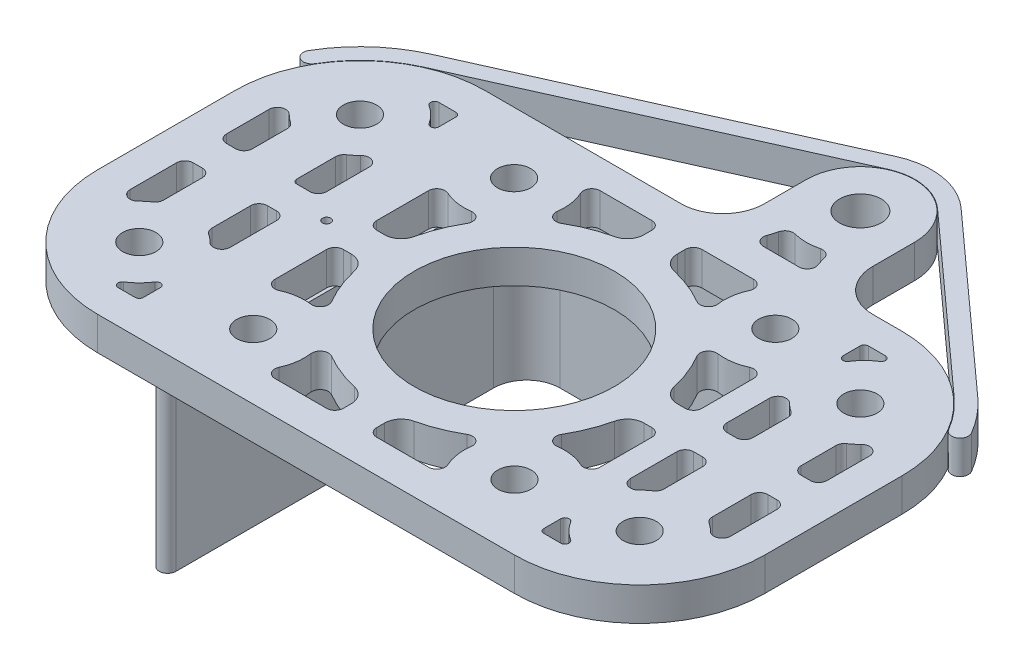
from build123d import *

# Parameters (mm, degrees)
SKETCH1_R             = 2
SKETCH1_R_2           = 12
SKETCH1_R_3           = 0.5
SKETCH1_R_4           = 2.5
BOSS_EXTRUDE1_DEPTH   = 4
BOSS_EXTRUDE1_2_DEPTH = 4
BOSS_EXTRUDE2_DEPTH   = 20
BOSS_EXTRUDE3_DEPTH   = 3


with BuildPart() as part:
    # Sketch1 → Boss-Extrude1 (new body)
    with BuildSketch(Plane(origin=(0, 0, 0), x_dir=(1, 0, 0), z_dir=(0, 1, 0))):
        with BuildLine():
            Line((-26.5, -23), (-3, -23))
            ThreePointArc((-3, -23), (0.535533906, -24.464466094), (2, -28))
            Line((2, -28), (2, -33))
            ThreePointArc((2, -33), (8.5, -39.5), (15, -33))
            Line((15, -33), (15, -28))
            ThreePointArc((15, -28), (16.464466094, -24.464466094), (20, -23))
            Line((20, -23), (23.5, -23))
            ThreePointArc((23.5, -23), (34.106601718, -18.606601718), (38.5, -8))
            Line((38.5, -8), (38.5, 8.46372283))
            ThreePointArc((38.5, 8.46372283), (34.106601718, 19.070324548), (23.5, 23.46372283))
            Line((23.5, 23.46372283), (-26.5, 23.46372283))
            ThreePointArc((-26.5, 23.46372283), (-37.106601718, 19.070324548), (-41.5, 8.46372283))
            Line((-41.5, 8.46372283), (-41.5, -8))
            ThreePointArc((-41.5, -8), (-37.106601718, -18.606601718), (-26.5, -23))
        make_face()
        with Locations(Location((-31.5, 13.46372283, 0), (0, 0, 270))):
            Circle(SKETCH1_R, mode=Mode.SUBTRACT)
        with Locations(Location((28.5, 13.46372283, 0), (0, 0, 270))):
            Circle(SKETCH1_R, mode=Mode.SUBTRACT)
        with Locations(Location((0, 0, 0), (0, 0, 270))):
            Circle(SKETCH1_R_2, mode=Mode.SUBTRACT)
        with Locations(Location((-15.637811111, 15.662146765, 0), (0, 0, 270))):
            Circle(SKETCH1_R, mode=Mode.SUBTRACT)
        with Locations(Location((15.662146765, 15.637811111, 0), (0, 0, 270))):
            Circle(SKETCH1_R, mode=Mode.SUBTRACT)
        with Locations(Location((15.637811111, -15.662146765, 0), (0, 0, 270))):
            Circle(SKETCH1_R, mode=Mode.SUBTRACT)
        with Locations(Location((-15.662146765, -15.637811111, 0), (0, 0, 270))):
            Circle(SKETCH1_R, mode=Mode.SUBTRACT)
        with Locations(Location((28.5, -13, 0), (0, 0, 270))):
            Circle(SKETCH1_R, mode=Mode.SUBTRACT)
        with Locations(Location((-31.5, -13, 0), (0, 0, 270))):
            Circle(SKETCH1_R, mode=Mode.SUBTRACT)
        with Locations(Location((-22.5, 0, 0), (0, 0, 270))):
            Circle(SKETCH1_R_3, mode=Mode.SUBTRACT)
        with Locations(Location((8.5, -33, 0), (0, 0, 270))):
            Circle(SKETCH1_R_4, mode=Mode.SUBTRACT)
        with BuildLine():
            Line((19.5, -3), (19.5, -9.206263146))
            ThreePointArc((19.5, -9.206263146), (19.041462955, -10.046987755), (18.086364264, -10.116705609))
            ThreePointArc((18.086364264, -10.116705609), (16.465532816, -9.638381302), (14.7756495, -9.624849747))
            ThreePointArc((14.7756495, -9.624849747), (13.810727907, -9.185503496), (13.78311178, -8.125627956))
            ThreePointArc((13.78311178, -8.125627956), (14.868163127, -5.910814262), (15.599936689, -3.555555556))
            ThreePointArc((15.599936689, -3.555555556), (16.302709646, -2.43652808), (17.549928775, -2))
            Line((17.549928775, -2), (18.5, -2))
            ThreePointArc((18.5, -2), (19.207106781, -2.292893219), (19.5, -3))
        make_face(mode=Mode.SUBTRACT)
        with BuildLine():
            Line((19.5, 9.206263146), (19.5, 3))
            ThreePointArc((19.5, 3), (19.207106781, 2.292893219), (18.5, 2))
            Line((18.5, 2), (17.549928775, 2))
            ThreePointArc((17.549928775, 2), (16.302709646, 2.43652808), (15.599936689, 3.555555556))
            ThreePointArc((15.599936689, 3.555555556), (14.868163127, 5.910814262), (13.78311178, 8.125627956))
            ThreePointArc((13.78311178, 8.125627956), (13.810727907, 9.185503495), (14.7756495, 9.624849747))
            ThreePointArc((14.7756495, 9.624849747), (16.465532816, 9.638381302), (18.086364264, 10.116705609))
            ThreePointArc((18.086364264, 10.116705609), (19.041462955, 10.046987755), (19.5, 9.206263146))
        make_face(mode=Mode.SUBTRACT)
        with BuildLine():
            Line((-34.4, 7.650806178), (-34.4, 3))
            ThreePointArc((-34.4, 3), (-34.692893219, 2.292893219), (-35.4, 2))
            Line((-35.4, 2), (-36.5, 2))
            ThreePointArc((-36.5, 2), (-37.207106781, 2.292893219), (-37.5, 3))
            Line((-37.5, 3), (-37.5, 8.564743344))
            ThreePointArc((-37.5, 8.564743344), (-36.877964473, 9.490563444), (-35.785714286, 9.264597557))
            ThreePointArc((-35.785714286, 9.264597557), (-35.334344076, 8.848768279), (-34.842857143, 8.481222843))
            ThreePointArc((-34.842857143, 8.481222843), (-34.517633053, 8.121368152), (-34.4, 7.650806178))
        make_face(mode=Mode.SUBTRACT)
        with BuildLine():
            Line((-28.6, 7.650806178), (-28.6, 3))
            ThreePointArc((-28.6, 3), (-28.307106781, 2.292893219), (-27.6, 2))
            Line((-27.6, 2), (-26.5, 2))
            ThreePointArc((-26.5, 2), (-25.792893219, 2.292893219), (-25.5, 3))
            Line((-25.5, 3), (-25.5, 8.564743344))
            ThreePointArc((-25.5, 8.564743344), (-26.122035527, 9.490563444), (-27.214285714, 9.264597557))
            ThreePointArc((-27.214285714, 9.264597557), (-27.665655924, 8.848768279), (-28.157142857, 8.481222843))
            ThreePointArc((-28.157142857, 8.481222843), (-28.482366947, 8.121368152), (-28.6, 7.650806178))
        make_face(mode=Mode.SUBTRACT)
        with BuildLine():
            Line((-37.5, -8.101020514), (-37.5, -3))
            ThreePointArc((-37.5, -3), (-37.207106781, -2.292893219), (-36.5, -2))
            Line((-36.5, -2), (-35.4, -2))
            ThreePointArc((-35.4, -2), (-34.692893219, -2.292893219), (-34.4, -3))
            Line((-34.4, -3), (-34.4, -7.187083348))
            ThreePointArc((-34.4, -7.187083348), (-34.517633053, -7.657645322), (-34.842857143, -8.017500013))
            ThreePointArc((-34.842857143, -8.017500013), (-35.334344076, -8.385045449), (-35.785714286, -8.800874727))
            ThreePointArc((-35.785714286, -8.800874727), (-36.877964473, -9.026840614), (-37.5, -8.101020514))
        make_face(mode=Mode.SUBTRACT)
        with BuildLine():
            Line((-3, -19.5), (-9.206263146, -19.5))
            ThreePointArc((-9.206263146, -19.5), (-10.046987755, -19.041462955), (-10.116705609, -18.086364264))
            ThreePointArc((-10.116705609, -18.086364264), (-9.638381302, -16.465532816), (-9.624849747, -14.7756495))
            ThreePointArc((-9.624849747, -14.7756495), (-9.185503496, -13.810727907), (-8.125627956, -13.78311178))
            ThreePointArc((-8.125627956, -13.78311178), (-5.910814262, -14.868163127), (-3.555555556, -15.599936689))
            ThreePointArc((-3.555555556, -15.599936689), (-2.43652808, -16.302709646), (-2, -17.549928775))
            Line((-2, -17.549928775), (-2, -18.5))
            ThreePointArc((-2, -18.5), (-2.292893219, -19.207106781), (-3, -19.5))
        make_face(mode=Mode.SUBTRACT)
        with BuildLine():
            Line((9.206263146, -19.5), (3, -19.5))
            ThreePointArc((3, -19.5), (2.292893219, -19.207106781), (2, -18.5))
            Line((2, -18.5), (2, -17.549928775))
            ThreePointArc((2, -17.549928775), (2.43652808, -16.302709646), (3.555555556, -15.599936689))
            ThreePointArc((3.555555556, -15.599936689), (5.910814262, -14.868163127), (8.125627956, -13.78311178))
            ThreePointArc((8.125627956, -13.78311178), (9.185503495, -13.810727907), (9.624849747, -14.7756495))
            ThreePointArc((9.624849747, -14.7756495), (9.638381302, -16.465532816), (10.116705609, -18.086364264))
            ThreePointArc((10.116705609, -18.086364264), (10.046987755, -19.041462955), (9.206263146, -19.5))
        make_face(mode=Mode.SUBTRACT)
        with BuildLine():
            Line((-19.5, 3), (-19.5, 9.206263146))
            ThreePointArc((-19.5, 9.206263146), (-19.041462955, 10.046987755), (-18.086364264, 10.116705609))
            ThreePointArc((-18.086364264, 10.116705609), (-16.465532816, 9.638381302), (-14.7756495, 9.624849747))
            ThreePointArc((-14.7756495, 9.624849747), (-13.810727907, 9.185503496), (-13.78311178, 8.125627956))
            ThreePointArc((-13.78311178, 8.125627956), (-14.868163127, 5.910814262), (-15.599936689, 3.555555556))
            ThreePointArc((-15.599936689, 3.555555556), (-16.302709646, 2.43652808), (-17.549928775, 2))
            Line((-17.549928775, 2), (-18.5, 2))
            ThreePointArc((-18.5, 2), (-19.207106781, 2.292893219), (-19.5, 3))
        make_face(mode=Mode.SUBTRACT)
        with BuildLine():
            Line((-19.5, -9.206263146), (-19.5, -3))
            ThreePointArc((-19.5, -3), (-19.207106781, -2.292893219), (-18.5, -2))
            Line((-18.5, -2), (-17.549928775, -2))
            ThreePointArc((-17.549928775, -2), (-16.302709646, -2.43652808), (-15.599936689, -3.555555556))
            ThreePointArc((-15.599936689, -3.555555556), (-14.868163127, -5.910814262), (-13.78311178, -8.125627956))
            ThreePointArc((-13.78311178, -8.125627956), (-13.810727907, -9.185503495), (-14.7756495, -9.624849747))
            ThreePointArc((-14.7756495, -9.624849747), (-16.465532816, -9.638381302), (-18.086364264, -10.116705609))
            ThreePointArc((-18.086364264, -10.116705609), (-19.041462955, -10.046987755), (-19.5, -9.206263146))
        make_face(mode=Mode.SUBTRACT)
        with BuildLine():
            Line((-9.206263146, 19.5), (-3, 19.5))
            ThreePointArc((-3, 19.5), (-2.292893219, 19.207106781), (-2, 18.5))
            Line((-2, 18.5), (-2, 17.549928775))
            ThreePointArc((-2, 17.549928775), (-2.43652808, 16.302709646), (-3.555555556, 15.599936689))
            ThreePointArc((-3.555555556, 15.599936689), (-5.910814262, 14.868163127), (-8.125627956, 13.78311178))
            ThreePointArc((-8.125627956, 13.78311178), (-9.185503495, 13.810727907), (-9.624849747, 14.7756495))
            ThreePointArc((-9.624849747, 14.7756495), (-9.638381302, 16.465532816), (-10.116705609, 18.086364264))
            ThreePointArc((-10.116705609, 18.086364264), (-10.046987755, 19.041462955), (-9.206263146, 19.5))
        make_face(mode=Mode.SUBTRACT)
        with BuildLine():
            Line((-25.5, 16.927824445), (-25.5, 18.96372283))
            ThreePointArc((-25.5, 18.96372283), (-25.64644661, 19.317276221), (-26, 19.46372283))
            Line((-26, 19.46372283), (-28.035898385, 19.46372283))
            ThreePointArc((-28.035898385, 19.46372283), (-28.516282846, 19.102397879), (-28.30236774, 18.540645907))
            ThreePointArc((-28.30236774, 18.540645907), (-27.257359313, 17.706363517), (-26.423076923, 16.66135509))
            ThreePointArc((-26.423076923, 16.66135509), (-25.861324951, 16.447439984), (-25.5, 16.927824445))
        make_face(mode=Mode.SUBTRACT)
        with BuildLine():
            Line((2, 18.5), (2, 17.549928775))
            ThreePointArc((2, 17.549928775), (2.43652808, 16.302709646), (3.555555556, 15.599936689))
            ThreePointArc((3.555555556, 15.599936689), (5.910814262, 14.868163127), (8.125627956, 13.78311178))
            ThreePointArc((8.125627956, 13.78311178), (9.185503496, 13.810727907), (9.624849747, 14.7756495))
            ThreePointArc((9.624849747, 14.7756495), (9.638381302, 16.465532816), (10.116705609, 18.086364264))
            ThreePointArc((10.116705609, 18.086364264), (10.046987755, 19.041462955), (9.206263146, 19.5))
            Line((9.206263146, 19.5), (3, 19.5))
            ThreePointArc((3, 19.5), (2.292893219, 19.207106781), (2, 18.5))
        make_face(mode=Mode.SUBTRACT)
        with BuildLine():
            Line((-26.5, -2), (-28.1, -2))
            ThreePointArc((-28.1, -2), (-28.453553391, -2.146446609), (-28.6, -2.5))
            Line((-28.6, -2.5), (-28.6, -7.187083348))
            ThreePointArc((-28.6, -7.187083348), (-28.482366947, -7.657645322), (-28.157142857, -8.017500013))
            ThreePointArc((-28.157142857, -8.017500013), (-27.665655924, -8.385045449), (-27.214285714, -8.800874727))
            ThreePointArc((-27.214285714, -8.800874727), (-26.122035527, -9.026840614), (-25.5, -8.101020514))
            Line((-25.5, -8.101020514), (-25.5, -3))
            ThreePointArc((-25.5, -3), (-25.792893219, -2.292893219), (-26.5, -2))
        make_face(mode=Mode.SUBTRACT)
        with BuildLine():
            Line((-25.5, -16.464101615), (-25.5, -18.5))
            ThreePointArc((-25.5, -18.5), (-25.64644661, -18.853553391), (-26, -19))
            Line((-26, -19), (-28.035898385, -19))
            ThreePointArc((-28.035898385, -19), (-28.516282846, -18.638675049), (-28.30236774, -18.076923077))
            ThreePointArc((-28.30236774, -18.076923077), (-27.257359313, -17.242640687), (-26.423076923, -16.19763226))
            ThreePointArc((-26.423076923, -16.19763226), (-25.861324951, -15.983717154), (-25.5, -16.464101615))
        make_face(mode=Mode.SUBTRACT)
        with BuildLine():
            Line((23, -19.46372283), (25.035898385, -19.46372283))
            ThreePointArc((25.035898385, -19.46372283), (25.516282846, -19.102397879), (25.30236774, -18.540645907))
            ThreePointArc((25.30236774, -18.540645907), (24.257359313, -17.706363517), (23.423076923, -16.66135509))
            ThreePointArc((23.423076923, -16.66135509), (22.861324951, -16.447439984), (22.5, -16.927824445))
            Line((22.5, -16.927824445), (22.5, -18.96372283))
            ThreePointArc((22.5, -18.96372283), (22.646446609, -19.317276221), (23, -19.46372283))
        make_face(mode=Mode.SUBTRACT)
        with BuildLine():
            Line((22.5, -8.101020514), (22.5, -3))
            ThreePointArc((22.5, -3), (22.792893219, -2.292893219), (23.5, -2))
            Line((23.5, -2), (24.6, -2))
            ThreePointArc((24.6, -2), (25.307106781, -2.292893219), (25.6, -3))
            Line((25.6, -3), (25.6, -7.187083348))
            ThreePointArc((25.6, -7.187083348), (25.482366947, -7.657645322), (25.157142857, -8.017500013))
            ThreePointArc((25.157142857, -8.017500013), (24.665655924, -8.385045449), (24.214285714, -8.800874727))
            ThreePointArc((24.214285714, -8.800874727), (23.122035527, -9.026840614), (22.5, -8.101020514))
        make_face(mode=Mode.SUBTRACT)
        with BuildLine():
            Line((22.5, 16.927824445), (22.5, 18.96372283))
            ThreePointArc((22.5, 18.96372283), (22.646446609, 19.317276221), (23, 19.46372283))
            Line((23, 19.46372283), (25.035898385, 19.46372283))
            ThreePointArc((25.035898385, 19.46372283), (25.516282846, 19.102397879), (25.30236774, 18.540645907))
            ThreePointArc((25.30236774, 18.540645907), (24.257359313, 17.706363517), (23.423076923, 16.66135509))
            ThreePointArc((23.423076923, 16.66135509), (22.861324951, 16.447439984), (22.5, 16.927824445))
        make_face(mode=Mode.SUBTRACT)
        with BuildLine():
            Line((34.5, -8.101020514), (34.5, -3))
            ThreePointArc((34.5, -3), (34.207106781, -2.292893219), (33.5, -2))
            Line((33.5, -2), (32.4, -2))
            ThreePointArc((32.4, -2), (31.692893219, -2.292893219), (31.4, -3))
            Line((31.4, -3), (31.4, -7.187083348))
            ThreePointArc((31.4, -7.187083348), (31.517633053, -7.657645322), (31.842857143, -8.017500013))
            ThreePointArc((31.842857143, -8.017500013), (32.334344076, -8.385045449), (32.785714286, -8.800874727))
            ThreePointArc((32.785714286, -8.800874727), (33.877964473, -9.026840614), (34.5, -8.101020514))
        make_face(mode=Mode.SUBTRACT)
        with BuildLine():
            Line((25.6, 7.650806178), (25.6, 3))
            ThreePointArc((25.6, 3), (25.307106781, 2.292893219), (24.6, 2))
            Line((24.6, 2), (23.5, 2))
            ThreePointArc((23.5, 2), (22.792893219, 2.292893219), (22.5, 3))
            Line((22.5, 3), (22.5, 8.564743344))
            ThreePointArc((22.5, 8.564743344), (23.122035527, 9.490563444), (24.214285714, 9.264597557))
            ThreePointArc((24.214285714, 9.264597557), (24.665655924, 8.848768279), (25.157142857, 8.481222843))
            ThreePointArc((25.157142857, 8.481222843), (25.482366947, 8.121368152), (25.6, 7.650806178))
        make_face(mode=Mode.SUBTRACT)
        with BuildLine():
            Line((31.4, 7.650806178), (31.4, 3))
            ThreePointArc((31.4, 3), (31.692893219, 2.292893219), (32.4, 2))
            Line((32.4, 2), (33.5, 2))
            ThreePointArc((33.5, 2), (34.207106781, 2.292893219), (34.5, 3))
            Line((34.5, 3), (34.5, 8.564743344))
            ThreePointArc((34.5, 8.564743344), (33.877964473, 9.490563444), (32.785714286, 9.264597557))
            ThreePointArc((32.785714286, 9.264597557), (32.334344076, 8.848768279), (31.842857143, 8.481222843))
            ThreePointArc((31.842857143, 8.481222843), (31.517633053, 8.121368152), (31.4, 7.650806178))
        make_face(mode=Mode.SUBTRACT)
        with BuildLine():
            Line((10.632503002, -23.5), (6.367496998, -23.5))
            ThreePointArc((6.367496998, -23.5), (5.545913161, -23.929912287), (5.430747298, -24.85))
            ThreePointArc((5.430747298, -24.85), (5.613124693, -25.389620139), (5.761001589, -25.939696345))
            ThreePointArc((5.761001589, -25.939696345), (6.210826608, -26.562725893), (6.969853382, -26.682670554))
            ThreePointArc((6.969853382, -26.682670554), (8.5, -26.5), (10.030146618, -26.682670554))
            ThreePointArc((10.030146618, -26.682670554), (10.789173392, -26.562725893), (11.238998411, -25.939696345))
            ThreePointArc((11.238998411, -25.939696345), (11.386875307, -25.389620139), (11.569252702, -24.85))
            ThreePointArc((11.569252702, -24.85), (11.454086839, -23.929912287), (10.632503002, -23.5))
        make_face(mode=Mode.SUBTRACT)
    extrude(amount=BOSS_EXTRUDE1_DEPTH)

    # Sketch2 → Boss-Extrude2 (add)
    with BuildSketch(Plane(origin=(0, 0, 0), x_dir=(1, 0, 0), z_dir=(0, 1, 0))):
        with BuildLine():
            Line((-21.1, 21.46372283), (-21.1, -16.6))
            ThreePointArc((-21.1, -16.6), (-19.342640687, -20.842640687), (-15.1, -22.6))
            Line((-15.1, -22.6), (16.499327399, -22.6))
            ThreePointArc((16.499327399, -22.6), (17.499327399, -21.6), (16.499327399, -20.6))
            Line((16.499327399, -20.6), (-15.1, -20.6))
            ThreePointArc((-15.1, -20.6), (-17.928427125, -19.428427125), (-19.1, -16.6))
            Line((-19.1, -16.6), (-19.1, 21.46372283))
            ThreePointArc((-19.1, 21.46372283), (-20.1, 22.46372283), (-21.1, 21.46372283))
        make_face()
    extrude(amount=-BOSS_EXTRUDE2_DEPTH)

    # Sketch3 → Boss-Extrude3 (add)
    # profile 1 of 2: a face of its own
    with BuildSketch(Plane(origin=(0, 0, 0), x_dir=(1, 0, 0), z_dir=(0, 1, 0))):
        with BuildLine():
            Line((31.4, 5.56372283), (31.4, -5.1))
            ThreePointArc((31.4, -5.1), (28.5, -8), (25.6, -5.1))
            Line((25.6, -5.1), (25.6, 5.56372283))
            ThreePointArc((25.6, 5.56372283), (28.5, 8.46372283), (31.4, 5.56372283))
        make_face()
        with BuildLine():
            Line((27.6, 5.56372283), (27.6, -5.1))
            ThreePointArc((27.6, -5.1), (28.5, -6), (29.4, -5.1))
            Line((29.4, -5.1), (29.4, 5.56372283))
            ThreePointArc((29.4, 5.56372283), (28.5, 6.46372283), (27.6, 5.56372283))
        make_face(mode=Mode.SUBTRACT)
    # profile 2 of 2: a face of its own
    with BuildSketch(Plane(origin=(0, 0, 0), x_dir=(1, 0, 0), z_dir=(0, 1, 0))):
        with BuildLine():
            Line((-28.6, -5.1), (-28.6, 5.56372283))
            ThreePointArc((-28.6, 5.56372283), (-31.5, 8.46372283), (-34.4, 5.56372283))
            Line((-34.4, 5.56372283), (-34.4, -5.1))
            ThreePointArc((-34.4, -5.1), (-31.5, -8), (-28.6, -5.1))
        make_face()
        with BuildLine():
            Line((-32.4, -5.1), (-32.4, 5.56372283))
            ThreePointArc((-32.4, 5.56372283), (-31.5, 6.46372283), (-30.6, 5.56372283))
            Line((-30.6, 5.56372283), (-30.6, -5.1))
            ThreePointArc((-30.6, -5.1), (-31.5, -6), (-32.4, -5.1))
        make_face(mode=Mode.SUBTRACT)
    extrude(amount=-BOSS_EXTRUDE3_DEPTH)


with BuildPart() as body_2:
    # Sketch1 → Boss-Extrude1 2 (new body)
    with BuildSketch(Plane(origin=(0, 0, 0), x_dir=(1, 0, 0), z_dir=(0, 1, 0))):
        with BuildLine():
            Line((12.890073837, -37.861044302), (33.58711622, -19.169269732))
            ThreePointArc((33.58711622, -19.169269732), (35.181994447, -17.488598724), (36.5, -15.583040287))
            ThreePointArc((36.5, -15.583040287), (37.867643873, -15.223109409), (38.227574751, -16.590753282))
            ThreePointArc((38.227574751, -16.590753282), (36.734418958, -18.749542076), (34.927596781, -20.653558069))
            Line((34.927596781, -20.653558069), (14.230554398, -39.345332639))
            ThreePointArc((14.230554398, -39.345332639), (9.833521023, -41.445366877), (5.003353556, -40.802305021))
            Line((5.003353556, -40.802305021), (-33.472844663, -23.558982528))
            ThreePointArc((-33.472844663, -23.558982528), (-37.895881071, -20.682128946), (-41.227574751, -16.590753283))
            ThreePointArc((-41.227574751, -16.590753283), (-40.867643873, -15.22310941), (-39.5, -15.583040288))
            ThreePointArc((-39.5, -15.583040288), (-36.559120828, -19.194489187), (-32.65491567, -21.733881938))
            Line((-32.65491567, -21.733881938), (5.821282549, -38.977204432))
            ThreePointArc((5.821282549, -38.977204432), (9.52158628, -39.469842461), (12.890073837, -37.861044302))
        make_face()
    extrude(amount=BOSS_EXTRUDE1_2_DEPTH)


with BuildPart() as body_3:
    # Mirror1: mirrored copy
    add(part.part.mirror(Plane(origin=(0, 4, -23.46372283), x_dir=(1, 0, 0), z_dir=(0, 0, -1))))


with BuildPart() as body_4:
    # Mirror1 2: mirrored copy
    add(body_2.part.mirror(Plane(origin=(0, 4, -23.46372283), x_dir=(1, 0, 0), z_dir=(0, 0, -1))))


solid = Compound([body_3.part, body_4.part])
